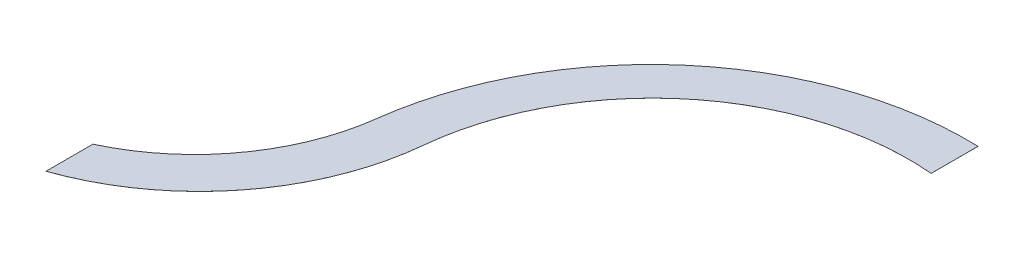
from build123d import *

# Parameters (mm, degrees)
RESSALTO_EXTRUS_O14_DEPTH = 0.01


with BuildPart() as part:
    # Esboço1 → Ressalto-extrusão14 (new body)
    with BuildSketch(Plane(origin=(0, 0, 0), x_dir=(1, 0, 0), z_dir=(0, 1, 0))):
        with BuildLine():
            Line((670.398690008, 1026.180894538), (670.398690008, 1006.180894538))
            ThreePointArc((670.398690008, 1006.180894538), (590.855594913, 981.607972814), (551.653165319, 908.163422483))
            ThreePointArc((551.653165319, 908.163422483), (529.32165926, 852.817907084), (480.747678864, 818.142401809))
            Line((480.747678864, 818.142401809), (480.747678864, 838.142401809))
            ThreePointArc((480.747678864, 838.142401809), (515.310995982, 866.576361287), (531.852739627, 908.163422483))
            ThreePointArc((531.852739627, 908.163422483), (578.286840553, 993.983727047), (670.398690008, 1026.180894538))
        make_face()
    extrude(amount=RESSALTO_EXTRUS_O14_DEPTH)


solid = part.part
